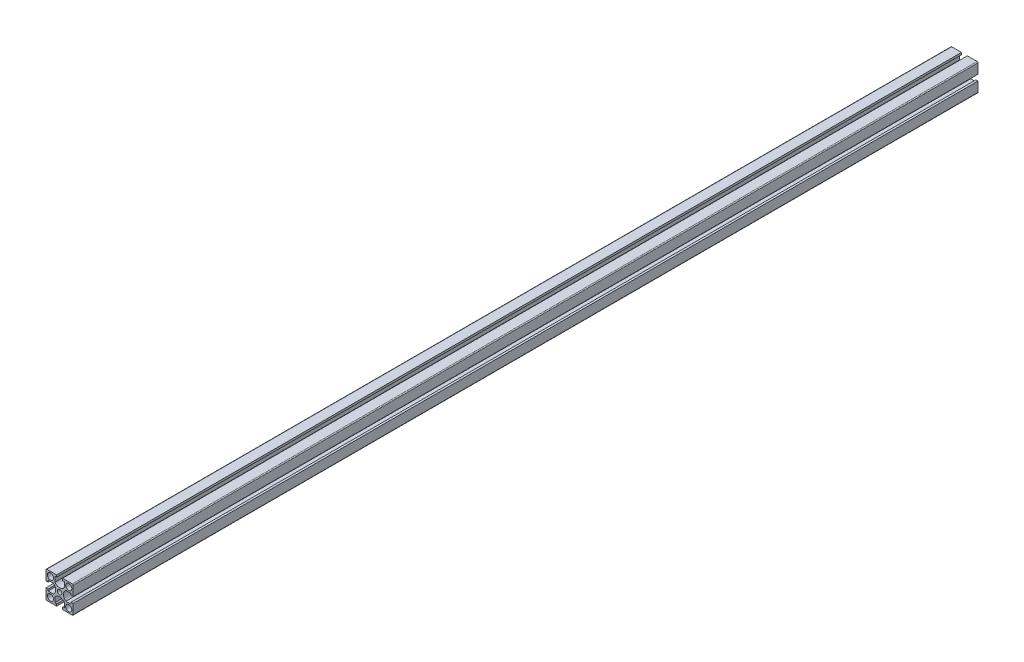
from build123d import *

# Parameters (mm, degrees)
SKETCH_1_R      = 2.5
SKETCH_1_R_2    = 3.4
EXTRUDE_1_DEPTH = 1000


with BuildPart() as part:
    # 草图1 → 凸台-拉伸1 (new body)
    with BuildSketch(Plane.XY):
        with BuildLine():
            Line((-2.798233949, -17.227303989), (7.951766051, -17.227303989))
            ThreePointArc((7.951766051, -17.227303989), (8.658872832, -16.93441077), (8.951766051, -16.227303989))
            Line((8.951766051, -16.227303989), (8.951766051, -5.477303989))
            Line((8.951766051, -5.477303989), (6.651766051, -5.477303989))
            Line((6.651766051, -5.477303989), (6.651766051, -7.427303989))
            Line((6.651766051, -7.427303989), (0.851766051, -7.427303989))
            ThreePointArc((0.851766051, -7.427303989), (-1.748233949, -2.227303989), (0.851766051, 2.972696011))
            Line((0.851766051, 2.972696011), (6.651766051, 2.972696011))
            Line((6.651766051, 2.972696011), (6.651766051, 1.022696011))
            Line((6.651766051, 1.022696011), (8.951766051, 1.022696011))
            Line((8.951766051, 1.022696011), (8.951766051, 11.772696011))
            ThreePointArc((8.951766051, 11.772696011), (8.658872832, 12.479802792), (7.951766051, 12.772696011))
            Line((7.951766051, 12.772696011), (-2.798233949, 12.772696011))
            Line((-2.798233949, 12.772696011), (-2.798233949, 10.472696011))
            Line((-2.798233949, 10.472696011), (-0.848233949, 10.472696011))
            Line((-0.848233949, 10.472696011), (-0.848233949, 4.672696011))
            ThreePointArc((-0.848233949, 4.672696011), (-6.048233949, 2.072696011), (-11.248233949, 4.672696011))
            Line((-11.248233949, 4.672696011), (-11.248233949, 10.472696011))
            Line((-11.248233949, 10.472696011), (-9.298233949, 10.472696011))
            Line((-9.298233949, 10.472696011), (-9.298233949, 12.772696011))
            Line((-9.298233949, 12.772696011), (-20.048233949, 12.772696011))
            ThreePointArc((-20.048233949, 12.772696011), (-20.75534073, 12.479802792), (-21.048233949, 11.772696011))
            Line((-21.048233949, 11.772696011), (-21.048233949, 1.022696011))
            Line((-21.048233949, 1.022696011), (-18.748233949, 1.022696011))
            Line((-18.748233949, 1.022696011), (-18.748233949, 2.972696011))
            Line((-18.748233949, 2.972696011), (-12.948233949, 2.972696011))
            ThreePointArc((-12.948233949, 2.972696011), (-10.348233949, -2.227303989), (-12.948233949, -7.427303989))
            Line((-12.948233949, -7.427303989), (-18.748233949, -7.427303989))
            Line((-18.748233949, -7.427303989), (-18.748233949, -5.477303989))
            Line((-18.748233949, -5.477303989), (-21.048233949, -5.477303989))
            Line((-21.048233949, -5.477303989), (-21.048233949, -16.227303989))
            ThreePointArc((-21.048233949, -16.227303989), (-20.75534073, -16.93441077), (-20.048233949, -17.227303989))
            Line((-20.048233949, -17.227303989), (-9.298233949, -17.227303989))
            Line((-9.298233949, -17.227303989), (-9.298233949, -14.927303989))
            Line((-9.298233949, -14.927303989), (-11.248233949, -14.927303989))
            Line((-11.248233949, -14.927303989), (-11.248233949, -9.127303989))
            ThreePointArc((-11.248233949, -9.127303989), (-6.048233949, -6.527303989), (-0.848233949, -9.127303989))
            Line((-0.848233949, -9.127303989), (-0.848233949, -14.927303989))
            Line((-0.848233949, -14.927303989), (-2.798233949, -14.927303989))
            Line((-2.798233949, -14.927303989), (-2.798233949, -17.227303989))
        make_face()
        with Locations((-6.048233949, -2.227303989)):
            Circle(SKETCH_1_R, mode=Mode.SUBTRACT)
        with Locations((-16.148233949, -12.327303989)):
            Circle(SKETCH_1_R_2, mode=Mode.SUBTRACT)
        with Locations((4.051766051, -12.327303989)):
            Circle(SKETCH_1_R_2, mode=Mode.SUBTRACT)
        with Locations((4.051766051, 7.872696011)):
            Circle(SKETCH_1_R_2, mode=Mode.SUBTRACT)
        with Locations((-16.148233949, 7.872696011)):
            Circle(SKETCH_1_R_2, mode=Mode.SUBTRACT)
    extrude(amount=EXTRUDE_1_DEPTH)


solid = part.part
